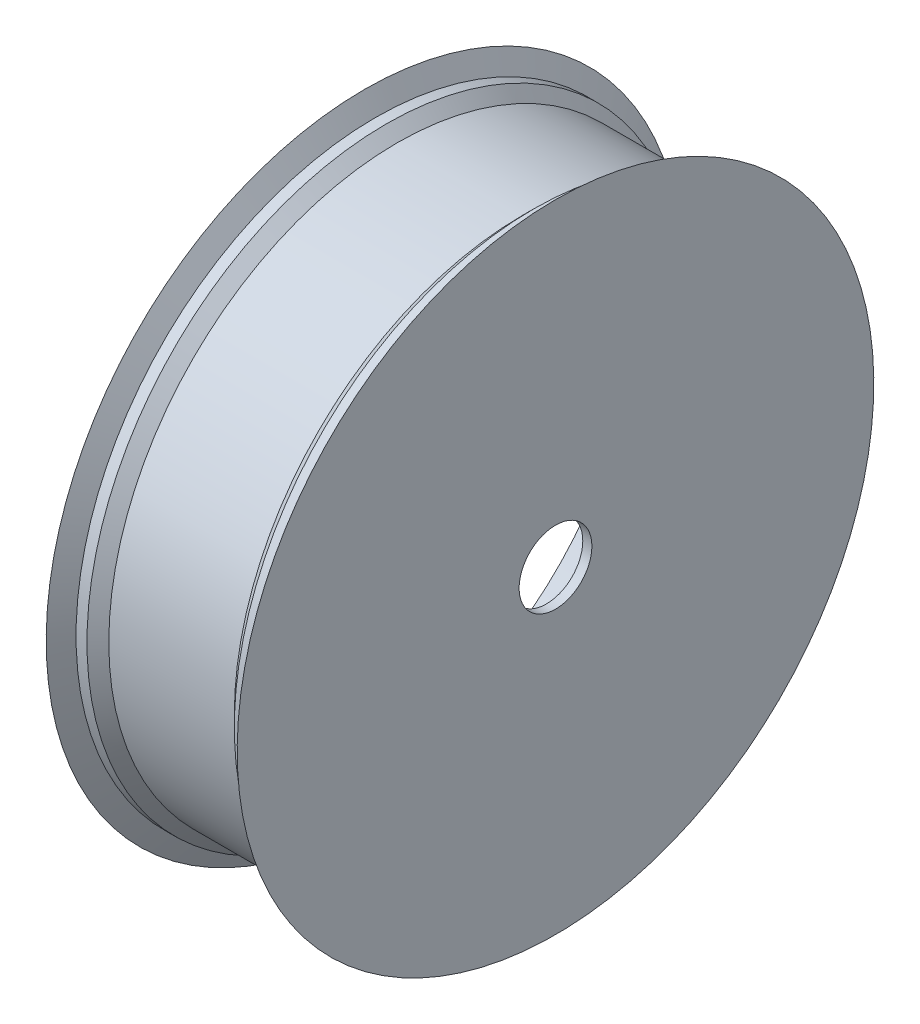
from build123d import *

# Parameters (mm, degrees)
SKETCH2_R          = 300
CUT_EXTRUDE1_DEPTH = 200
SKETCH3_R          = 40
CUT_EXTRUDE2_DEPTH = 200


with BuildPart() as part:
    # Sketch1 → Revolve2 (revolve)
    with BuildSketch(Plane.XY):
        Polygon((0, 0), (0, 350), (12, 329.169330118), (24, 329.169330118), (36, 317.169330118), (174, 317.169330118), (186, 329.169330118), (198, 329.169330118), (210, 350), (210, 0), align=None)
    revolve(axis=Axis((210, 0, 0), (-1, 0, 0)))

    # Sketch2 → Cut-Extrude1 (cut)
    with BuildSketch(Plane.ZY):
        with Locations(Location((0, 0, 0), (0, 0, 270))):
            Circle(SKETCH2_R)
    extrude(amount=-CUT_EXTRUDE1_DEPTH, mode=Mode.SUBTRACT)

    # Sketch3 → Cut-Extrude2 (cut)
    with BuildSketch(Plane(origin=(210, 0, 0), x_dir=(0, 0, -1), z_dir=(1, 0, 0))):
        with Locations(Location((0, 0, 0), (0, 0, 90))):
            Circle(SKETCH3_R)
    extrude(amount=-CUT_EXTRUDE2_DEPTH, mode=Mode.SUBTRACT)


solid = part.part
